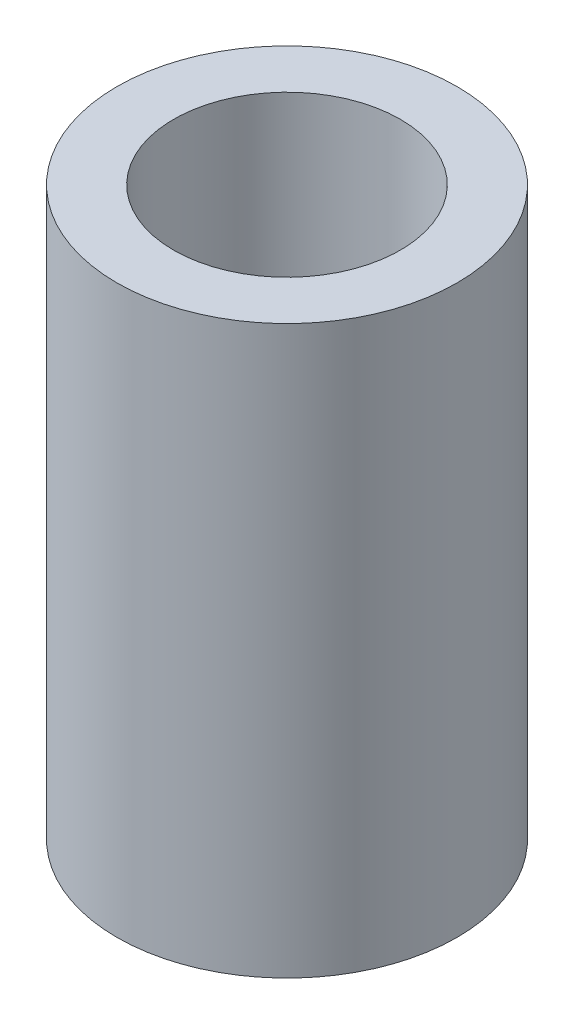
from build123d import *

# Parameters (mm, degrees)
SKETCH1_R           = 6
BOSS_EXTRUDE1_DEPTH = 20
SKETCH2_R           = 4
CUT_EXTRUDE1_DEPTH  = 22.725560982


with BuildPart() as part:
    # Sketch1 → Boss-Extrude1 (new body)
    with BuildSketch(Plane(origin=(0, 0, 0), x_dir=(1, 0, 0), z_dir=(0, 1, 0))):
        with Locations(Location((0, 0, 0), (0, 0, 270))):
            Circle(SKETCH1_R)
    extrude(amount=BOSS_EXTRUDE1_DEPTH)

    # Sketch2 → Cut-Extrude1 (cut, through all)
    with BuildSketch(Plane(origin=(0, 20, 0), x_dir=(1, 0, 0), z_dir=(0, 1, 0))):
        with Locations(Location((0, 0, 0), (0, 0, 270))):
            Circle(SKETCH2_R)
    extrude(amount=-CUT_EXTRUDE1_DEPTH, mode=Mode.SUBTRACT)


solid = part.part
